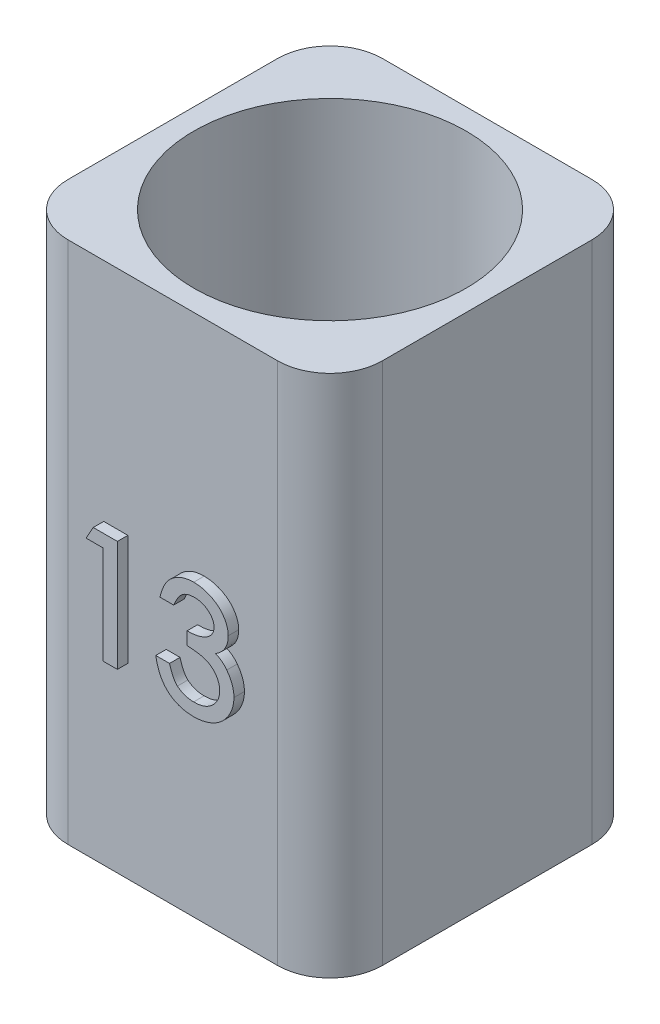
from build123d import *

# Parameters (mm, degrees)
SKETCH1_W           = 15
SKETCH1_H           = 15
BOSS_EXTRUDE1_DEPTH = 25
SKETCH2_R           = 6.5
CUT_EXTRUDE1_DEPTH  = 24
BOSS_EXTRUDE3_DEPTH = 0.5
FILLET1_R           = 2.5
FILLET2_R           = 2.5
FILLET3_R           = 2.5
FILLET4_R           = 2.5


with BuildPart() as part:
    # Sketch1 → Boss-Extrude1 (new body)
    with BuildSketch(Plane(origin=(0, 0, 0), x_dir=(1, 0, 0), z_dir=(0, 1, 0))):
        Rectangle(SKETCH1_W, SKETCH1_H)
    extrude(amount=BOSS_EXTRUDE1_DEPTH)

    # Sketch2 → Cut-Extrude1 (cut)
    with BuildSketch(Plane(origin=(0, 25, 0), x_dir=(1, 0, 0), z_dir=(0, 1, 0))):
        with Locations(Location((0, 0, 0), (0, 0, 270))):
            Circle(SKETCH2_R)
    extrude(amount=-CUT_EXTRUDE1_DEPTH, mode=Mode.SUBTRACT)

    # Sketch3 → Boss-Extrude3 (add)
    with BuildSketch(Plane.XY.offset(7.5)):
        Polygon((-3.300679086, 14.210073329), (-2.149487179, 14.210073329), (-2.149487179, 8.918406662), (-2.827905982, 8.918406662), (-2.827905982, 13.599496406), (-3.642008546, 13.599496406), align=None)
        with BuildLine():
            Line((0.536627271, 12.921077603), (-0.114230768, 12.921077603))
            add(Edge.make_bspline(
                [(-0.114230768, 12.921077603), (-0.100961493, 12.97960801), (-0.074987112, 13.094180286), (-0.022481053, 13.257850992), (0.036681085, 13.410915565), (0.105032166, 13.552204246), (0.18423708, 13.680615371), (0.269979947, 13.798627118), (0.365943067, 13.903778446), (0.470019389, 13.997523947), (0.581683486, 14.078506256), (0.697631037, 14.150346176), (0.818785512, 14.210579109), (0.944384477, 14.26104525), (1.07507306, 14.299243023), (1.210742775, 14.325043417), (1.350596953, 14.343167819), (1.445719829, 14.344887341), (1.493833802, 14.34575709)],
                knots=[0, 0, 0, 0, 1.225194122, 2.398296627, 3.506547767, 4.574817873, 5.598350885, 6.584148364, 7.54966307, 8.500147383, 9.439776218, 10.36307994, 11.282851771, 12.199447467, 13.124300948, 14.058371117, 15.017907346, 16, 16, 16, 16], degree=3))
            add(Edge.make_bspline(
                [(1.493833802, 14.34575709), (1.568531598, 14.343241617), (1.716386062, 14.338262569), (1.934195583, 14.30064004), (2.143451442, 14.236059647), (2.342206832, 14.148760529), (2.525877316, 14.041870431), (2.688320429, 13.917169074), (2.828024385, 13.777755988), (2.940950824, 13.623466287), (3.030374612, 13.461564399), (3.094266969, 13.295358681), (3.134897281, 13.126546953), (3.139755234, 13.012814321), (3.142179488, 12.956058572)],
                knots=[0, 0, 0, 0, 1.126551995, 2.229861531, 3.322496069, 4.422827045, 5.497949776, 6.520418829, 7.504194933, 8.464779191, 9.395175895, 10.286118409, 11.144725379, 12, 12, 12, 12], degree=3))
            add(Edge.make_bspline(
                [(3.142179488, 12.956058572), (3.140445745, 12.901156816), (3.137054029, 12.793752712), (3.107562398, 12.637619364), (3.060141337, 12.491151022), (2.992304739, 12.354955699), (2.905853989, 12.228760675), (2.799194916, 12.113655832), (2.674433691, 12.007543566), (2.580108351, 11.947900553), (2.531602565, 11.917229779)],
                knots=[0, 0, 0, 0, 1.039530957, 2.033630564, 2.999111873, 3.948297759, 4.906578666, 5.887513816, 6.913676835, 8, 8, 8, 8], degree=3))
            add(Edge.make_bspline(
                [(2.531602565, 11.917229779), (2.584015029, 11.894773533), (2.688596929, 11.849965164), (2.830947045, 11.754438191), (2.961806101, 11.640433311), (3.034980771, 11.549892367), (3.072217549, 11.503818321)],
                knots=[0, 0, 0, 0, 0.990740455, 1.976887035, 2.970487876, 4, 4, 4, 4], degree=3))
            add(Edge.make_bspline(
                [(3.072217549, 11.503818321), (3.099199896, 11.466345), (3.152494918, 11.392328407), (3.223193721, 11.27672227), (3.280661614, 11.15750979), (3.330599467, 11.03769875), (3.36747824, 10.915047449), (3.394052073, 10.790627171), (3.410528936, 10.664010495), (3.412537758, 10.578814684), (3.413547009, 10.536011497)],
                knots=[0, 0, 0, 0, 1.060434252, 2.094549648, 3.107169572, 4.097295716, 5.072846837, 6.043796276, 7.017184609, 8, 8, 8, 8], degree=3))
            add(Edge.make_bspline(
                [(3.413547009, 10.536011497), (3.410884478, 10.462255283), (3.405544113, 10.314318949), (3.355756698, 10.095274277), (3.279517444, 9.87949602), (3.190263242, 9.706554209), (3.106229875, 9.572451392), (3.035363238, 9.476738788), (2.959072469, 9.385890858), (2.875352239, 9.302061826), (2.786861322, 9.222237669), (2.690771017, 9.149101484), (2.588777456, 9.08119272), (2.481373466, 9.018753249), (2.368425447, 8.963923848), (2.25238329, 8.914613155), (2.131846342, 8.875070384), (2.009065285, 8.840230397), (1.881992689, 8.815601905), (1.751948266, 8.795813187), (1.618014874, 8.78571627), (1.527767864, 8.783727609), (1.482173479, 8.782722902)],
                knots=[0, 0, 0, 0, 1.521749033, 3.052244174, 4.617626532, 6.240122497, 7.060311358, 7.885196768, 8.698339091, 9.508724546, 10.330730427, 11.158549718, 12.000758621, 12.860902525, 13.722748307, 14.593084173, 15.463328201, 16.341708233, 17.227848997, 18.135261118, 19.057900949, 20, 20, 20, 20], degree=3))
            add(Edge.make_bspline(
                [(1.482173479, 8.782722902), (1.424534496, 8.784009629), (1.311091495, 8.786542119), (1.144761754, 8.80453533), (0.985505782, 8.835279516), (0.833832902, 8.878940615), (0.688754462, 8.933826723), (0.551698785, 9.002209379), (0.421541769, 9.081928184), (0.298933599, 9.17442013), (0.185538343, 9.280567865), (0.081506968, 9.400204964), (-0.010374271, 9.534920483), (-0.093429441, 9.682647813), (-0.165387817, 9.845073744), (-0.2274602, 10.020890903), (-0.280102876, 10.210673196), (-0.304959207, 10.342867972), (-0.317756409, 10.41092803)],
                knots=[0, 0, 0, 0, 1.031951552, 2.031050468, 2.99141865, 3.932589319, 4.853771667, 5.764839348, 6.670884665, 7.583203617, 8.509779947, 9.447179227, 10.415909331, 11.424319639, 12.477825485, 13.592421652, 14.760465984, 16, 16, 16, 16], degree=3))
            Line((-0.317756409, 10.41092803), (0.340521836, 10.41092803))
            add(Edge.make_bspline(
                [(0.340521836, 10.41092803), (0.353642264, 10.365961117), (0.378781523, 10.27980274), (0.419994104, 10.156753231), (0.464328654, 10.046178878), (0.510010421, 9.946594394), (0.557269249, 9.858400707), (0.607129332, 9.781740097), (0.658566183, 9.715895757), (0.697291944, 9.679781396), (0.715772237, 9.662547287)],
                knots=[0, 0, 0, 0, 1.326285875, 2.54121601, 3.672658499, 4.697761427, 5.642367002, 6.502616728, 7.285434817, 8, 8, 8, 8], degree=3))
            add(Edge.make_bspline(
                [(0.715772237, 9.662547287), (0.742522938, 9.640711231), (0.795504144, 9.597463744), (0.882749756, 9.543986167), (0.972720363, 9.496111587), (1.068630016, 9.460087268), (1.167568548, 9.429638048), (1.271216907, 9.408640374), (1.37901821, 9.395682345), (1.452455657, 9.394100021), (1.489593684, 9.393299825)],
                knots=[0, 0, 0, 0, 0.989076215, 1.958918776, 2.928708407, 3.907140108, 4.891221483, 5.894723991, 6.935341563, 8, 8, 8, 8], degree=3))
            add(Edge.make_bspline(
                [(1.489593684, 9.393299825), (1.535564055, 9.394385116), (1.625629073, 9.396511414), (1.756948364, 9.411119566), (1.881465881, 9.436816065), (1.998634057, 9.472540053), (2.109229372, 9.518420277), (2.212093691, 9.574823167), (2.308446041, 9.640715678), (2.395915, 9.717176651), (2.474283993, 9.800159305), (2.544168737, 9.886739881), (2.603887301, 9.976492114), (2.651728418, 10.070571325), (2.689422936, 10.167818589), (2.715520817, 10.268504187), (2.732250533, 10.372562903), (2.734159496, 10.443017471), (2.735128206, 10.47876991)],
                knots=[0, 0, 0, 0, 1.196856166, 2.344877135, 3.434653565, 4.502660904, 5.529498559, 6.546397239, 7.551828815, 8.562675341, 9.564818567, 10.520268272, 11.456705045, 12.365995596, 13.262962725, 14.166698094, 15.069683942, 16, 16, 16, 16], degree=3))
            add(Edge.make_bspline(
                [(2.735128206, 10.47876991), (2.733019747, 10.525931359), (2.728805675, 10.620190586), (2.696820658, 10.758793296), (2.645521251, 10.893210689), (2.573056785, 11.020296841), (2.484855208, 11.139353782), (2.379063635, 11.243639788), (2.258444845, 11.332741278), (2.145936485, 11.394343128), (2.04399224, 11.435052667), (1.955096408, 11.463378228), (1.854145901, 11.488537229), (1.741612839, 11.510578276), (1.61711797, 11.529541882), (1.480621111, 11.545196857), (1.331763956, 11.55768696), (1.228486925, 11.5640896), (1.174764958, 11.567420084)],
                knots=[0, 0, 0, 0, 1.058801672, 2.116173898, 3.179133807, 4.280986043, 5.392377071, 6.498225676, 7.604871823, 8.752253925, 9.368447799, 10.068883315, 10.846735517, 11.704571958, 12.644304815, 13.675272135, 14.790738352, 16, 16, 16, 16], degree=3))
            Line((1.174764958, 11.567420084), (1.174764958, 12.174816919))
            add(Edge.make_bspline(
                [(1.174764958, 12.174816919), (1.244792803, 12.176105368), (1.379225183, 12.178578803), (1.572223534, 12.201059455), (1.747870691, 12.237255938), (1.905314059, 12.288971698), (2.042647935, 12.35297773), (2.161778734, 12.421655594), (2.259068443, 12.499974424), (2.335704951, 12.585390944), (2.392038085, 12.677435042), (2.43474333, 12.771757648), (2.458395507, 12.871531566), (2.461961466, 12.938985103), (2.463760685, 12.973019042)],
                knots=[0, 0, 0, 0, 1.49683591, 2.87347434, 4.147795521, 5.325633569, 6.407353164, 7.383009189, 8.25851615, 9.066624807, 9.823413814, 10.557538392, 11.272200497, 12, 12, 12, 12], degree=3))
            add(Edge.make_bspline(
                [(2.463760685, 12.973019042), (2.462989319, 12.998165871), (2.461468952, 13.047730405), (2.447975215, 13.120981745), (2.427069851, 13.191877769), (2.3971723, 13.260279908), (2.358008252, 13.325569974), (2.311713599, 13.389235409), (2.255758848, 13.449820095), (2.192602073, 13.507555086), (2.123479924, 13.561310327), (2.048694297, 13.608437464), (1.969006195, 13.647585237), (1.884409587, 13.67941094), (1.795493257, 13.704957023), (1.701488974, 13.722876037), (1.602919685, 13.73365892), (1.535556151, 13.734666896), (1.501254007, 13.735180167)],
                knots=[0, 0, 0, 0, 0.88508993, 1.744517034, 2.61478088, 3.484243336, 4.365825862, 5.291885516, 6.252189795, 7.265246754, 8.303377192, 9.332440159, 10.373327524, 11.425096702, 12.51242353, 13.62794981, 14.792129802, 16, 16, 16, 16], degree=3))
            add(Edge.make_bspline(
                [(1.501254007, 13.735180167), (1.451999534, 13.733049362), (1.355744815, 13.728885274), (1.215849293, 13.698979708), (1.08596836, 13.646935622), (0.984693576, 13.587633927), (0.908608791, 13.527502106), (0.852738473, 13.471044634), (0.798434832, 13.40397858), (0.743075275, 13.32807166), (0.689987439, 13.24084643), (0.637503486, 13.143811145), (0.585220048, 13.036405205), (0.553221665, 12.960461885), (0.536627271, 12.921077603)],
                knots=[0, 0, 0, 0, 1.30644707, 2.553102055, 3.773430717, 5.004978473, 5.652102429, 6.34150733, 7.107309491, 7.939915375, 8.832283585, 9.813897121, 10.866284818, 12, 12, 12, 12], degree=3))
        make_face()
    extrude(amount=BOSS_EXTRUDE3_DEPTH)

    # Fillet1
    fillet1_edges = [part.edges().sort_by_distance(p)[0] for p in [
        (-7.5, 12.5, 7.5),
    ]]
    fillet(fillet1_edges, radius=FILLET1_R)

    # Fillet2
    fillet2_edges = [part.edges().sort_by_distance(p)[0] for p in [
        (7.5, 12.5, 7.5),
    ]]
    fillet(fillet2_edges, radius=FILLET2_R)

    # Fillet3
    fillet3_edges = [part.edges().sort_by_distance(p)[0] for p in [
        (7.5, 12.5, -7.5),
    ]]
    fillet(fillet3_edges, radius=FILLET3_R)

    # Fillet4
    fillet4_edges = [part.edges().sort_by_distance(p)[0] for p in [
        (-7.5, 12.5, -7.5),
    ]]
    fillet(fillet4_edges, radius=FILLET4_R)


solid = part.part
